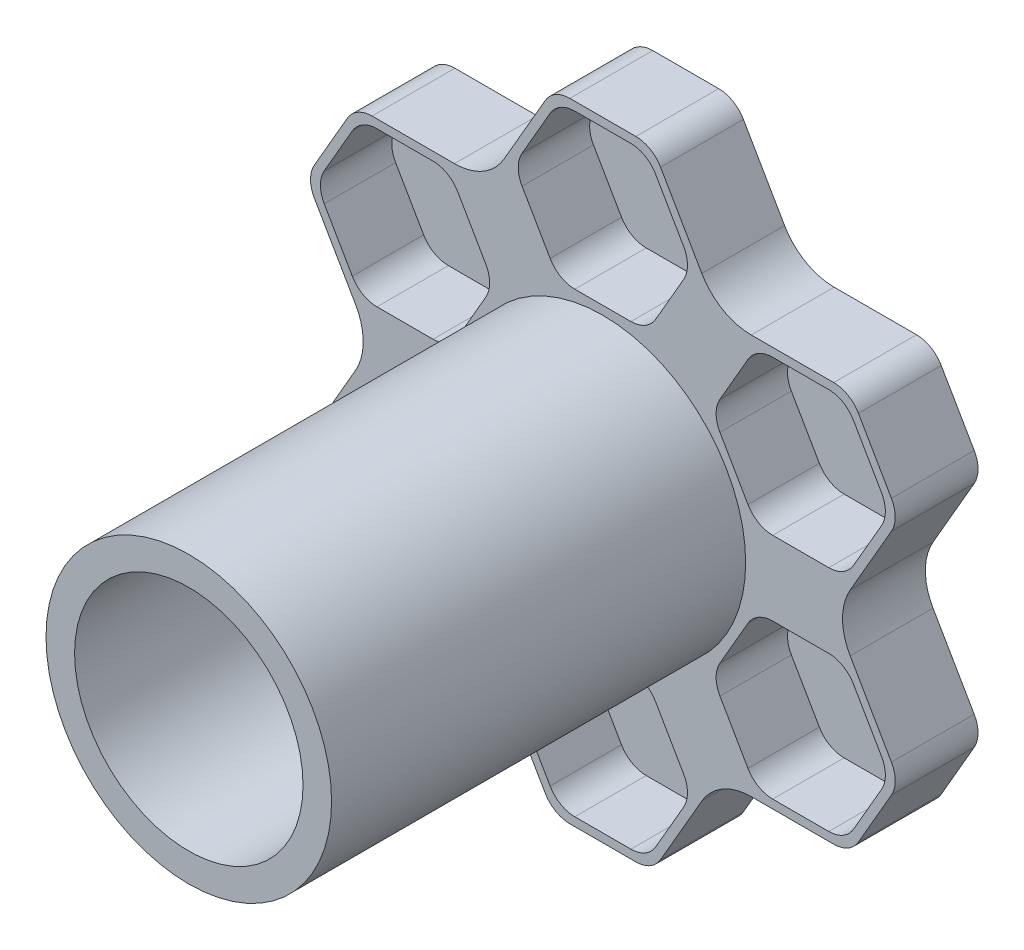
from build123d import *

# Parameters (mm, degrees)
BOSS_EXTRUDE2_DEPTH = 4
BOSS_EXTRUDE3_START = 25
BOSS_EXTRUDE3_DEPTH = 25
BOSS_EXTRUDE4_START = 25
BASE_SKETCH_4_R     = 50
BASE_SKETCH_4_R_2   = 40
BASE_SKETCH_4_R_3   = 10
BOSS_EXTRUDE4_DEPTH = 40
BOSS_EXTRUDE5_START = 65
BASE_SKETCH_5_R     = 50
BASE_SKETCH_5_R_2   = 40
BASE_SKETCH_5_R_3   = 10
BOSS_EXTRUDE5_DEPTH = 5
BOSS_EXTRUDE6_START = 70
BASE_SKETCH_7_R     = 50
BASE_SKETCH_7_R_2   = 40
BOSS_EXTRUDE6_DEPTH = 100
FILLET1_R           = 10
FILLET2_R           = 10


with BuildPart() as part:
    # Base_Sketch → Boss-Extrude2 (new body)
    with BuildSketch(Plane.XY):
        with BuildLine():
            Line((34.641016151, 80), (17.320508076, 110))
            Line((17.320508076, 110), (-17.320508076, 110))
            Line((-17.320508076, 110), (-34.641016151, 80))
            ThreePointArc((-34.641016151, 80), (-41.961524227, 72.679491924), (-51.961524227, 70))
            Line((-51.961524227, 70), (-86.602540378, 70))
            Line((-86.602540378, 70), (-103.923048454, 40))
            Line((-103.923048454, 40), (-86.602540378, 10))
            ThreePointArc((-86.602540378, 10), (-83.923048454, 0), (-86.602540378, -10))
            Line((-86.602540378, -10), (-103.923048454, -40))
            Line((-103.923048454, -40), (-86.602540378, -70))
            Line((-86.602540378, -70), (-51.961524227, -70))
            ThreePointArc((-51.961524227, -70), (-41.961524227, -72.679491924), (-34.641016151, -80))
            Line((-34.641016151, -80), (-17.320508076, -110))
            Line((-17.320508076, -110), (17.320508076, -110))
            Line((17.320508076, -110), (34.641016151, -80))
            ThreePointArc((34.641016151, -80), (41.961524227, -72.679491924), (51.961524227, -70))
            Line((51.961524227, -70), (86.602540378, -70))
            Line((86.602540378, -70), (103.923048454, -40))
            Line((103.923048454, -40), (86.602540378, -10))
            ThreePointArc((86.602540378, -10), (83.923048454, 0), (86.602540378, 10))
            Line((86.602540378, 10), (103.923048454, 40))
            Line((103.923048454, 40), (86.602540378, 70))
            Line((86.602540378, 70), (51.961524227, 70))
            ThreePointArc((51.961524227, 70), (41.961524227, 72.679491924), (34.641016151, 80))
        make_face()
    extrude(amount=-BOSS_EXTRUDE2_DEPTH)

    # Base_Sketch<3> → Boss-Extrude3 (add)
    with BuildSketch(Plane.XY.offset(BOSS_EXTRUDE3_START)):
        with BuildLine():
            Line((86.602540378, 10), (103.923048454, 40))
            Line((103.923048454, 40), (86.602540378, 70))
            Line((86.602540378, 70), (51.961524227, 70))
            ThreePointArc((51.961524227, 70), (41.961524227, 72.679491924), (34.641016151, 80))
            Line((34.641016151, 80), (17.320508076, 110))
            Line((17.320508076, 110), (-17.320508076, 110))
            Line((-17.320508076, 110), (-34.641016151, 80))
            ThreePointArc((-34.641016151, 80), (-41.961524227, 72.679491924), (-51.961524227, 70))
            Line((-51.961524227, 70), (-86.602540378, 70))
            Line((-86.602540378, 70), (-103.923048454, 40))
            Line((-103.923048454, 40), (-86.602540378, 10))
            ThreePointArc((-86.602540378, 10), (-83.923048454, 0), (-86.602540378, -10))
            Line((-86.602540378, -10), (-103.923048454, -40))
            Line((-103.923048454, -40), (-86.602540378, -70))
            Line((-86.602540378, -70), (-51.961524227, -70))
            ThreePointArc((-51.961524227, -70), (-41.961524227, -72.679491924), (-34.641016151, -80))
            Line((-34.641016151, -80), (-17.320508076, -110))
            Line((-17.320508076, -110), (17.320508076, -110))
            Line((17.320508076, -110), (34.641016151, -80))
            ThreePointArc((34.641016151, -80), (41.961524227, -72.679491924), (51.961524227, -70))
            Line((51.961524227, -70), (86.602540378, -70))
            Line((86.602540378, -70), (103.923048454, -40))
            Line((103.923048454, -40), (86.602540378, -10))
            ThreePointArc((86.602540378, -10), (83.923048454, 0), (86.602540378, 10))
        make_face()
        Polygon((-31.176914536, 80), (-15.588457268, 107), (15.588457268, 107), (31.176914536, 80), (15.588457268, 53), (-15.588457268, 53), align=None, mode=Mode.SUBTRACT)
        Polygon((53.693575035, 67), (84.870489571, 67), (100.458946839, 40), (84.870489571, 13), (53.693575035, 13), (38.105117767, 40), align=None, mode=Mode.SUBTRACT)
        Polygon((-84.870489571, 67), (-53.693575035, 67), (-38.105117767, 40), (-53.693575035, 13), (-84.870489571, 13), (-100.458946839, 40), align=None, mode=Mode.SUBTRACT)
        Polygon((-100.458946839, -40), (-84.870489571, -13), (-53.693575035, -13), (-38.105117767, -40), (-53.693575035, -67), (-84.870489571, -67), align=None, mode=Mode.SUBTRACT)
        Polygon((84.870489571, -13), (100.458946839, -40), (84.870489571, -67), (53.693575035, -67), (38.105117767, -40), (53.693575035, -13), align=None, mode=Mode.SUBTRACT)
        Polygon((-15.588457268, -107), (-31.176914536, -80), (-15.588457268, -53), (15.588457268, -53), (31.176914536, -80), (15.588457268, -107), align=None, mode=Mode.SUBTRACT)
    extrude(amount=-BOSS_EXTRUDE3_DEPTH)

    # Base_Sketch<4> → Boss-Extrude4 (add)
    # profile 1 of 3: a face of its own
    with BuildSketch(Plane.XY.offset(BOSS_EXTRUDE4_START)):
        Circle(BASE_SKETCH_4_R)
        Circle(BASE_SKETCH_4_R_2, mode=Mode.SUBTRACT)
    # profile 2 of 3: a face of its own
    with BuildSketch(Plane.XY.offset(BOSS_EXTRUDE4_START)):
        Circle(BASE_SKETCH_4_R_2)
        Circle(BASE_SKETCH_4_R_3, mode=Mode.SUBTRACT)
    # profile 3 of 3: a face of its own
    with BuildSketch(Plane.XY.offset(BOSS_EXTRUDE4_START)):
        Circle(BASE_SKETCH_4_R_3)
    extrude(amount=BOSS_EXTRUDE4_DEPTH)

    # Base_Sketch<5> → Boss-Extrude5 (add)
    # profile 1 of 3: a face of its own
    with BuildSketch(Plane.XY.offset(BOSS_EXTRUDE5_START)):
        Circle(BASE_SKETCH_5_R)
        Circle(BASE_SKETCH_5_R_2, mode=Mode.SUBTRACT)
    # profile 2 of 3: a face of its own
    with BuildSketch(Plane.XY.offset(BOSS_EXTRUDE5_START)):
        Circle(BASE_SKETCH_5_R_2)
        Circle(BASE_SKETCH_5_R_3, mode=Mode.SUBTRACT)
    # profile 3 of 3: a face of its own
    with BuildSketch(Plane.XY.offset(BOSS_EXTRUDE5_START)):
        Circle(BASE_SKETCH_5_R_3)
    extrude(amount=BOSS_EXTRUDE5_DEPTH)

    # Base_Sketch<7> → Boss-Extrude6 (add)
    with BuildSketch(Plane.XY.offset(BOSS_EXTRUDE6_START)):
        Circle(BASE_SKETCH_7_R)
        Circle(BASE_SKETCH_7_R_2, mode=Mode.SUBTRACT)
    extrude(amount=BOSS_EXTRUDE6_DEPTH)

    # Fillet1
    fillet1_edges = [part.edges().sort_by_distance(p)[0] for p in [
        (-15.588457268, 107, 12.5),
        (-31.176914536, 80, 12.5),
        (-15.588457268, 53, 12.5),
        (15.588457268, 53, 12.5),
        (31.176914536, 80, 12.5),
        (15.588457268, 107, 12.5),
        (-17.320508076, 110, 10.5),
        (17.320508076, 110, 10.5),
    ]]
    fillet(fillet1_edges, radius=FILLET1_R)

    # Fillet2
    fillet2_edges = [part.edges().sort_by_distance(p)[0] for p in [
        (-15.588457268, -107, 12.5),
        (15.588457268, -107, 12.5),
        (31.176914536, -80, 12.5),
        (15.588457268, -53, 12.5),
        (-15.588457268, -53, 12.5),
        (-31.176914536, -80, 12.5),
        (-100.458946839, -40, 12.5),
        (-84.870489571, -67, 12.5),
        (-53.693575035, -67, 12.5),
        (-38.105117767, -40, 12.5),
        (-53.693575035, -13, 12.5),
        (-84.870489571, -13, 12.5),
        (-84.870489571, 67, 12.5),
        (-100.458946839, 40, 12.5),
        (-84.870489571, 13, 12.5),
        (-53.693575035, 13, 12.5),
        (-38.105117767, 40, 12.5),
        (-53.693575035, 67, 12.5),
        (100.458946839, 40, 12.5),
        (84.870489571, 67, 12.5),
        (53.693575035, 67, 12.5),
        (38.105117767, 40, 12.5),
        (53.693575035, 13, 12.5),
        (84.870489571, 13, 12.5),
        (84.870489571, -13, 12.5),
        (53.693575035, -13, 12.5),
        (38.105117767, -40, 12.5),
        (53.693575035, -67, 12.5),
        (84.870489571, -67, 12.5),
        (100.458946839, -40, 12.5),
        (103.923048454, -40, 10.5),
        (86.602540378, -70, 10.5),
        (17.320508076, -110, 10.5),
        (-17.320508076, -110, 10.5),
        (-86.602540378, -70, 10.5),
        (-103.923048454, -40, 10.5),
        (-103.923048454, 40, 10.5),
        (-86.602540378, 70, 10.5),
        (86.602540378, 70, 10.5),
        (103.923048454, 40, 10.5),
    ]]
    fillet(fillet2_edges, radius=FILLET2_R)


solid = part.part
